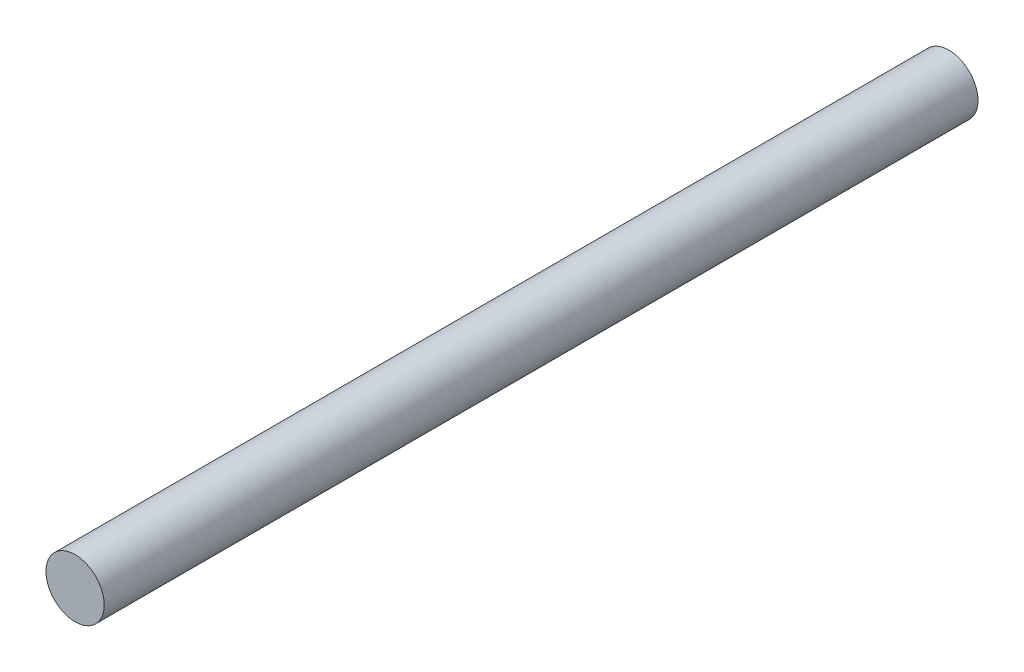
from build123d import *

# Parameters (mm, degrees)
SKETCH_1_R      = 2.5
EXTRUDE_1_DEPTH = 75


with BuildPart() as part:
    # Эскиз1 → Вытянуть1 (new body)
    with BuildSketch(Plane.XY):
        Circle(SKETCH_1_R)
    extrude(amount=EXTRUDE_1_DEPTH)


solid = part.part
